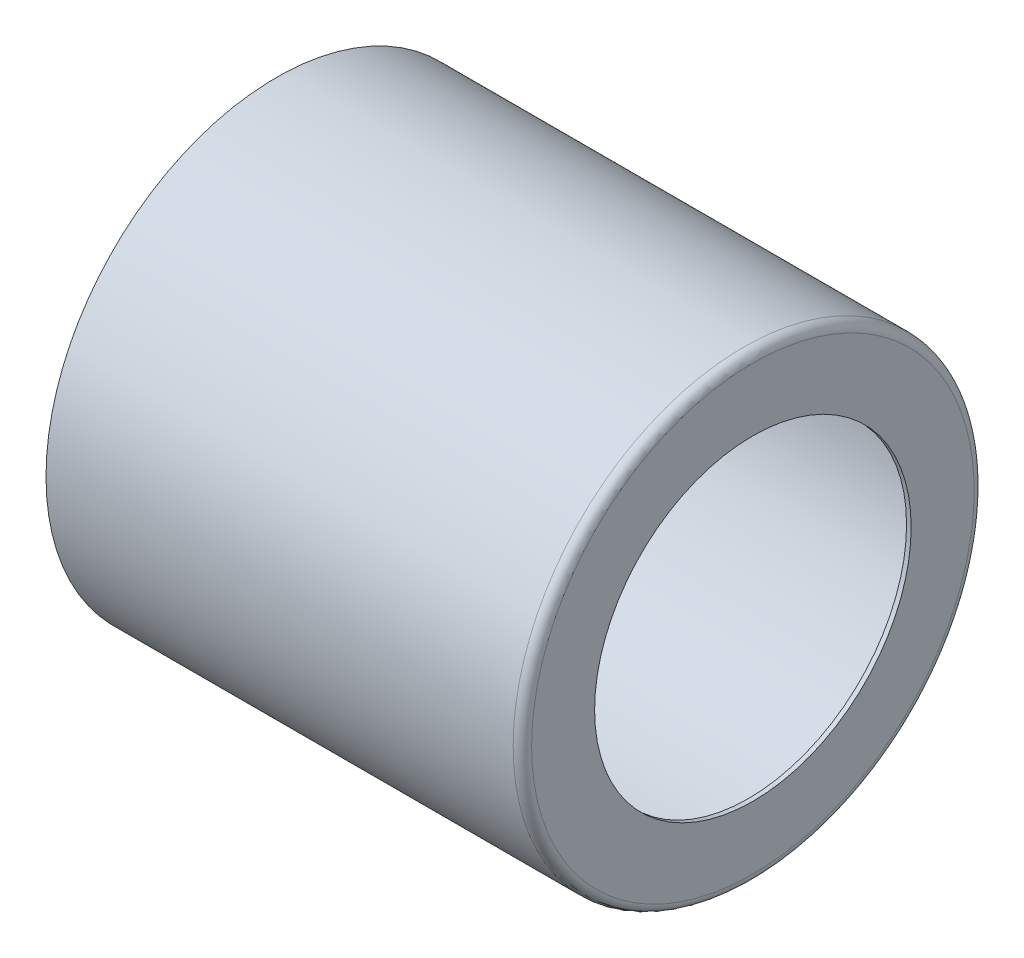
from build123d import *


with BuildPart() as part:
    # Sketch1 → Revolve1 (revolve)
    with BuildSketch(Plane.XY, mode=Mode.PRIVATE) as revolve1_sk:
        with BuildLine():
            Line((0, 75), (152, 75))
            ThreePointArc((152, 75), (154.121320344, 74.121320344), (155, 72))
            Line((155, 72), (155, 51.5))
            Line((155, 51.5), (153.5, 51.5))
            Line((153.5, 51.5), (153.5, 70.5))
            ThreePointArc((153.5, 70.5), (152.621320344, 72.621320344), (150.5, 73.5))
            Line((150.5, 73.5), (0, 73.5))
            Line((0, 73.5), (0, 75))
        make_face()
    revolve(revolve1_sk.sketch.rotate(Axis((-120.017932179, 0, 0), (1, 0, 0)), 90), axis=Axis((-120.017932179, 0, 0), (1, 0, 0)))


solid = part.part
